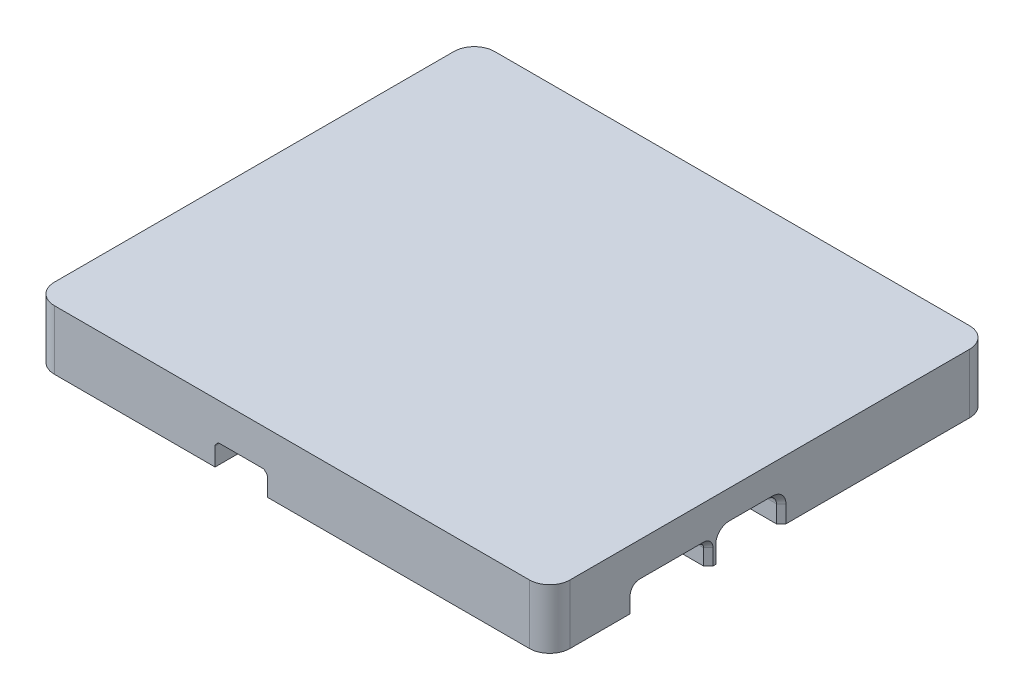
from build123d import *

# Parameters (mm, degrees)
BOSS_EXTRUDE1_DEPTH = 8.76
BOSS_EXTRUDE2_START = -0.95
BOSS_EXTRUDE2_DEPTH = 0.95
SKETCH4_W           = 12.8
SKETCH4_H           = 6.9
CUT_EXTRUDE1_DEPTH  = 8
SKETCH5_W           = 1.3986406
SKETCH5_H           = 2.263006611
BOSS_EXTRUDE3_DEPTH = 7.81
CUT_EXTRUDE2_DEPTH  = 8
FILLET1_R           = 0.5
SKETCH8_W           = 8.94
SKETCH8_H           = 3.85
CUT_EXTRUDE6_DEPTH  = 8
FILLET2_R           = 1.28
BOSS_EXTRUDE5_START = 1.9
BOSS_EXTRUDE5_DEPTH = 1.9
CHAMFER1_SIZE       = 0.7
SKETCH14_R          = 1.6
CUT_EXTRUDE10_DEPTH = 6
SKETCH16_R          = 1.6
CUT_EXTRUDE11_DEPTH = 6
CUT_EXTRUDE12_DEPTH = 0.9
SKETCH19_W          = 7.7
SKETCH19_H          = 3.35
CUT_EXTRUDE13_DEPTH = 4
CHAMFER2_SIZE       = 0.5
FILLET3_R           = 0.4


with BuildPart() as part:
    # Sketch1 → Boss-Extrude1 (new body)
    with BuildSketch(Plane(origin=(0, 0, 0), x_dir=(1, 0, 0), z_dir=(0, 1, 0))):
        with BuildLine():
            ThreePointArc((0, 3), (0.878679656, 0.878679656), (3, 0))
            Line((3, 0), (73, 0))
            ThreePointArc((73, 0), (75.121320344, 0.878679656), (76, 3))
            Line((76, 3), (76, 55.62))
            Line((76, 55.62), (76, 57.326548644))
            Line((76, 57.326548644), (76, 61.882562509))
            ThreePointArc((76, 61.882562509), (75.121320344, 64.003882853), (73, 64.882562509))
            Line((73, 64.882562509), (3, 64.882562509))
            ThreePointArc((3, 64.882562509), (0.878679656, 64.003882853), (0, 61.882562509))
            Line((0, 61.882562509), (0, 57.326548644))
            Line((0, 57.326548644), (0, 55.62))
            Line((0, 55.62), (0, 3))
        make_face()
        with BuildLine():
            Line((65, 4), (11, 4))
            ThreePointArc((11, 4), (8.878679656, 4.878679656), (8, 7))
            Line((8, 7), (8, 53.326548644))
            ThreePointArc((8, 53.326548644), (8.878679656, 55.447868988), (11, 56.326548644))
            Line((11, 56.326548644), (65, 56.326548644))
            ThreePointArc((65, 56.326548644), (67.121320344, 55.447868988), (68, 53.326548644))
            Line((68, 53.326548644), (68, 7))
            ThreePointArc((68, 7), (67.121320344, 4.878679656), (65, 4))
        make_face(mode=Mode.SUBTRACT)
    extrude(amount=BOSS_EXTRUDE1_DEPTH)

    # Sketch2 → Boss-Extrude2 (add)
    with BuildSketch(Plane(origin=(0, 8.76, 0), x_dir=(1, 0, 0), z_dir=(0, 1, 0)).offset(BOSS_EXTRUDE2_START)):
        with BuildLine():
            Line((8, 48.62), (8, 7))
            ThreePointArc((8, 7), (8.878679656, 4.878679656), (11, 4))
            Line((11, 4), (65, 4))
            ThreePointArc((65, 4), (67.121320344, 4.878679656), (68, 7))
            Line((68, 7), (68, 48.62))
            Line((68, 48.62), (68, 53.326548644))
            ThreePointArc((68, 53.326548644), (67.121320344, 55.447868988), (65, 56.326548644))
            Line((65, 56.326548644), (11, 56.326548644))
            ThreePointArc((11, 56.326548644), (8.878679656, 55.447868988), (8, 53.326548644))
            Line((8, 53.326548644), (8, 48.62))
        make_face()
    extrude(amount=BOSS_EXTRUDE2_DEPTH)

    # Sketch4 → Cut-Extrude1 (cut)
    with BuildSketch(Plane.ZY):
        with Locations((-28.14, 3.45)):
            Rectangle(SKETCH4_W, SKETCH4_H)
    extrude(amount=-CUT_EXTRUDE1_DEPTH, mode=Mode.SUBTRACT)

    # Sketch5 → Boss-Extrude3 (add)
    with BuildSketch(Plane.XZ):
        with Locations((8.6993203, -20.608496695)):
            Rectangle(SKETCH5_W, SKETCH5_H)
        with Locations((8.6993203, -35.671503305)):
            Rectangle(SKETCH5_W, SKETCH5_H)
    extrude(amount=-BOSS_EXTRUDE3_DEPTH)

    # Sketch6 → Cut-Extrude2 (cut)
    with BuildSketch(Plane(origin=(76, 0, 0), x_dir=(0, 0, -1), z_dir=(1, 0, 0))):
        with BuildLine():
            Line((12.55338903, 2.34), (12.55338903, 0))
            Line((12.55338903, 0), (23.359580852, 0))
            Line((23.359580852, 0), (23.359580852, 2.34))
            ThreePointArc((23.359580852, 2.34), (23.154555599, 2.834974747), (22.659580852, 3.04))
            Line((22.659580852, 3.04), (13.25338903, 3.04))
            ThreePointArc((13.25338903, 3.04), (12.758414283, 2.834974747), (12.55338903, 2.34))
        make_face()
    extrude(amount=-CUT_EXTRUDE2_DEPTH, mode=Mode.SUBTRACT)

    # Fillet1
    fillet1_edges = [part.edges().sort_by_distance(p)[0] for p in [
        (4, 6.9, -34.54),
        (4, 6.9, -21.74),
    ]]
    fillet(fillet1_edges, radius=FILLET1_R)

    # Sketch8 → Cut-Extrude6 (cut)
    with BuildSketch(Plane(origin=(76, 0, 0), x_dir=(0, 0, -1), z_dir=(1, 0, 0))):
        with Locations((29.64, 1.925)):
            Rectangle(SKETCH8_W, SKETCH8_H)
    extrude(amount=-CUT_EXTRUDE6_DEPTH, mode=Mode.SUBTRACT)

    # Fillet2
    fillet2_edges = [part.edges().sort_by_distance(p)[0] for p in [
        (72, 3.85, -34.11),
        (72, 3.85, -25.17),
    ]]
    fillet(fillet2_edges, radius=FILLET2_R)

    # Sketch9 → Boss-Extrude5 (add)
    with BuildSketch(Plane.ZY.offset(-68).offset(BOSS_EXTRUDE5_START)):
        with BuildLine():
            Line((-34.11, 0.47), (-34.11, 2.57))
            ThreePointArc((-34.11, 2.57), (-33.73509668, 3.47509668), (-32.83, 3.85))
            Line((-32.83, 3.85), (-26.45, 3.85))
            ThreePointArc((-26.45, 3.85), (-25.54490332, 3.47509668), (-25.17, 2.57))
            Line((-25.17, 2.57), (-25.17, 0.47))
            Line((-25.17, 0.47), (-24.52, 0.47))
            Line((-24.52, 0.47), (-24.52, 2.57))
            ThreePointArc((-24.52, 2.57), (-25.085283912, 3.934716088), (-26.45, 4.5))
            Line((-26.45, 4.5), (-32.83, 4.5))
            ThreePointArc((-32.83, 4.5), (-34.194716088, 3.934716088), (-34.76, 2.57))
            Line((-34.76, 2.57), (-34.76, 0.47))
            Line((-34.76, 0.47), (-34.11, 0.47))
        make_face()
    extrude(amount=-BOSS_EXTRUDE5_DEPTH)

    # Chamfer1
    chamfer1_edges = [part.edges().sort_by_distance(p)[0] for p in [
        (76, 1.17, -23.359580852),
        (76, 2.834974747, -23.154555599),
        (76, 3.04, -17.956484941),
        (76, 2.834974747, -12.758414283),
        (76, 1.17, -12.55338903),
        (76, 1.285, -34.11),
        (76, 3.85, -29.64),
        (76, 1.285, -25.17),
        (76, 3.47509668, -33.73509668),
        (76, 3.47509668, -25.54490332),
    ]]
    chamfer(chamfer1_edges, length=CHAMFER1_SIZE)

    # Sketch14 → Cut-Extrude10 (cut)
    with BuildSketch(Plane(origin=(0, 0, 0), x_dir=(-1, 0, 0), z_dir=(0, -1, 0))):
        with Locations(Location((-4.7, 6, 0), (0, 0, 90))):
            Circle(SKETCH14_R)
        with Locations(Location((-4.7, 58.885125018, 0), (0, 0, 270))):
            Circle(SKETCH14_R)
    extrude(amount=-CUT_EXTRUDE10_DEPTH, mode=Mode.SUBTRACT)

    # Sketch16 → Cut-Extrude11 (cut)
    with BuildSketch(Plane(origin=(0, 0, 0), x_dir=(-1, 0, 0), z_dir=(0, -1, 0))):
        with Locations(Location((-71.3, 6, 0), (0, 0, 90))):
            Circle(SKETCH16_R)
        with Locations(Location((-71.3, 58.88, 0), (0, 0, 270))):
            Circle(SKETCH16_R)
    extrude(amount=-CUT_EXTRUDE11_DEPTH, mode=Mode.SUBTRACT)

    # Sketch18 → Cut-Extrude12 (cut)
    with BuildSketch(Plane(origin=(0, 0, -64.882562509), x_dir=(-1, 0, 0), z_dir=(0, 0, -1))):
        with BuildLine():
            Line((-64.583936573, -0.08), (-11.416063427, -0.08))
            Line((-11.416063427, -0.08), (-11.42000005, 2.410060225))
            ThreePointArc((-11.42000005, 2.410060225), (-11.704466584, 3.096728386), (-12.391153239, 3.381150275))
            Line((-12.391153239, 3.381150275), (-38.000003545, 3.38))
            Line((-38.000003545, 3.38), (-63.608843072, 3.381150275))
            ThreePointArc((-63.608843072, 3.381150275), (-64.295532112, 3.096729691), (-64.57999995, 2.410060225))
            Line((-64.57999995, 2.410060225), (-64.583936573, -0.08))
        make_face()
    extrude(amount=-CUT_EXTRUDE12_DEPTH, mode=Mode.SUBTRACT)

    # Sketch19 → Cut-Extrude13 (cut)
    with BuildSketch(Plane.XY):
        with Locations((30.53, 1.675)):
            Rectangle(SKETCH19_W, SKETCH19_H)
    extrude(amount=-CUT_EXTRUDE13_DEPTH, mode=Mode.SUBTRACT)

    # Chamfer2
    chamfer2_edges = [part.edges().sort_by_distance(p)[0] for p in [
        (34.38, 3.35, -2),
        (26.68, 3.35, -2),
    ]]
    chamfer(chamfer2_edges, length=CHAMFER2_SIZE)

    # Fillet3
    fillet3_edges = [part.edges().sort_by_distance(p)[0] for p in [
        (27.18, 3.35, -2),
        (33.88, 3.35, -2),
        (34.38, 2.85, -2),
        (26.68, 2.85, -2),
    ]]
    fillet(fillet3_edges, radius=FILLET3_R)


solid = part.part
